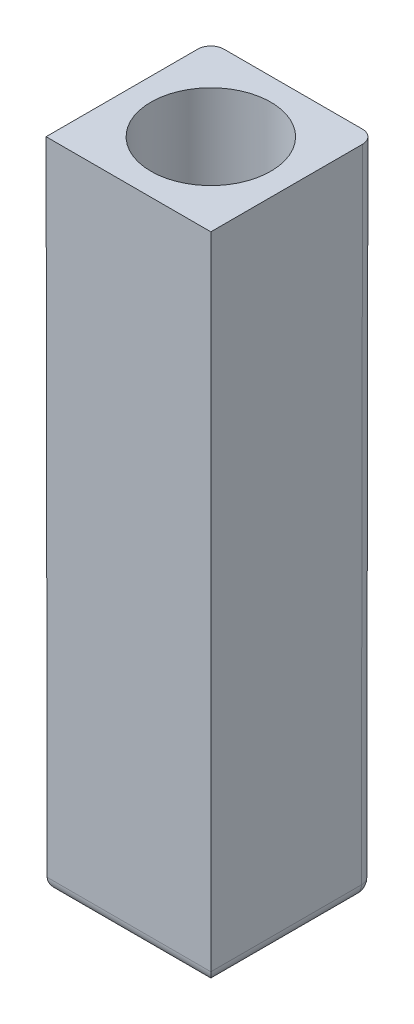
from build123d import *

# Parameters (mm, degrees)
SKETCH2_W           = 25
SKETCH2_H           = 25
SKETCH2_R           = 9.247
BOSS_EXTRUDE1_DEPTH = 100
BOSS_EXTRUDE1_DRAFT = -0.05
FILLET4_R           = 2


with BuildPart() as part:
    # Sketch2 → Boss-Extrude1 (with draft: the straight prism first)
    with BuildSketch(Plane(origin=(0, 0, 0), x_dir=(1, 0, 0), z_dir=(0, 1, 0))):
        Rectangle(SKETCH2_W, SKETCH2_H)
        Circle(SKETCH2_R, mode=Mode.SUBTRACT)
    extrude(amount=BOSS_EXTRUDE1_DEPTH)
    # Boss-Extrude1: the draft: its side faces are tilted about the plane it starts from
    boss_extrude1_sides = [part.faces().sort_by_distance(p)[0] for p in [
        (-12.5, 50, 0),
        (0, 50, 12.5),
        (12.5, 50, 0),
        (0, 50, -12.5),
        (-9.247, 50, 0),
    ]]
    draft(boss_extrude1_sides, Plane(origin=(0, 0, 0), x_dir=(1, 0, 0), z_dir=(0, 1, 0)), BOSS_EXTRUDE1_DRAFT)

    # Fillet4
    fillet4_edges = [part.edges().sort_by_distance(p)[0] for p in [
        (0, 0, 12.5),
        (-12.5, 0, 0),
        (0, 0, -12.5),
        (12.5, 0, 0),
        (-12.543633242, 50, -12.543633242),
        (12.543633242, 50, -12.543633242),
    ]]
    fillet(fillet4_edges, radius=FILLET4_R)


solid = part.part
